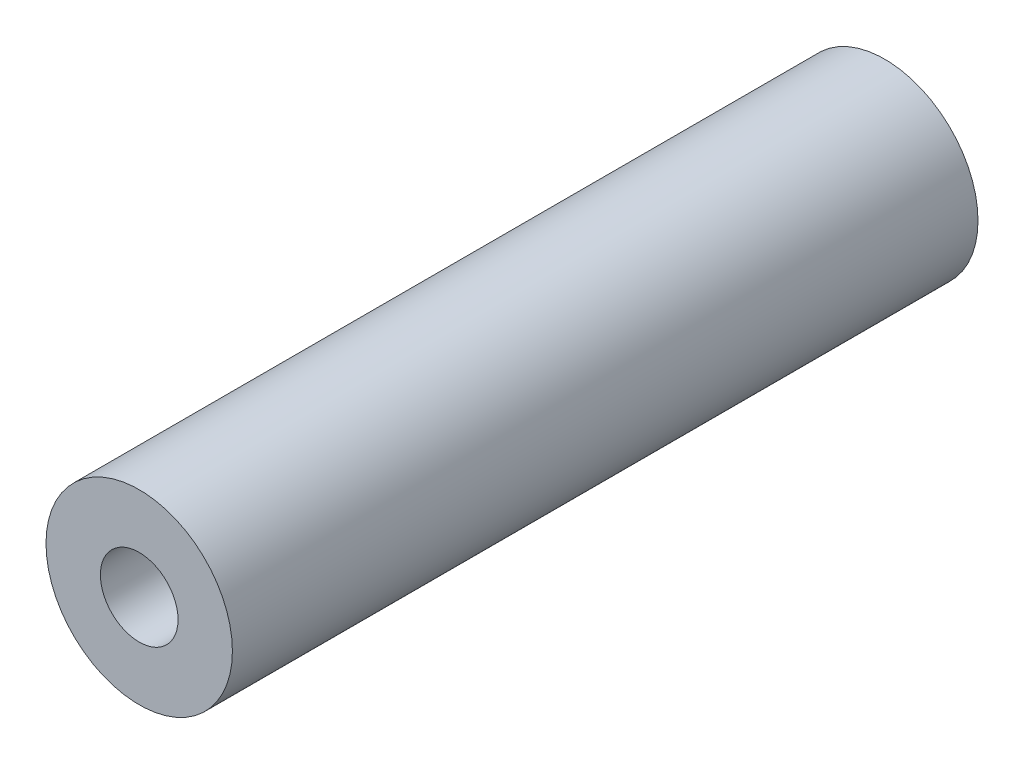
from build123d import *

# Parameters (mm, degrees)
SKETCH_1_R          = 3
EXTRUDE_1_DEPTH     = 12
SKETCH_2_R          = 1.25
CUT_EXTRUDE_1_DEPTH = 6


with BuildPart() as part:
    # ｽｹｯﾁ1 → ﾎﾞｽ - 押し出し1 (new, symmetric)
    with BuildSketch(Plane.XY):
        Circle(SKETCH_1_R)
    extrude(amount=EXTRUDE_1_DEPTH, both=True)

    # ｽｹｯﾁ2 → ｶｯﾄ - 押し出し1 (cut)
    with BuildSketch(Plane.XY.offset(12)):
        Circle(SKETCH_2_R)
    cut_extrude_1 = extrude(amount=-CUT_EXTRUDE_1_DEPTH, mode=Mode.SUBTRACT)

    # ﾐﾗｰ1: ｶｯﾄ - 押し出し1 across plane
    add(cut_extrude_1.mirror(Plane.XY), mode=Mode.SUBTRACT)


solid = part.part
